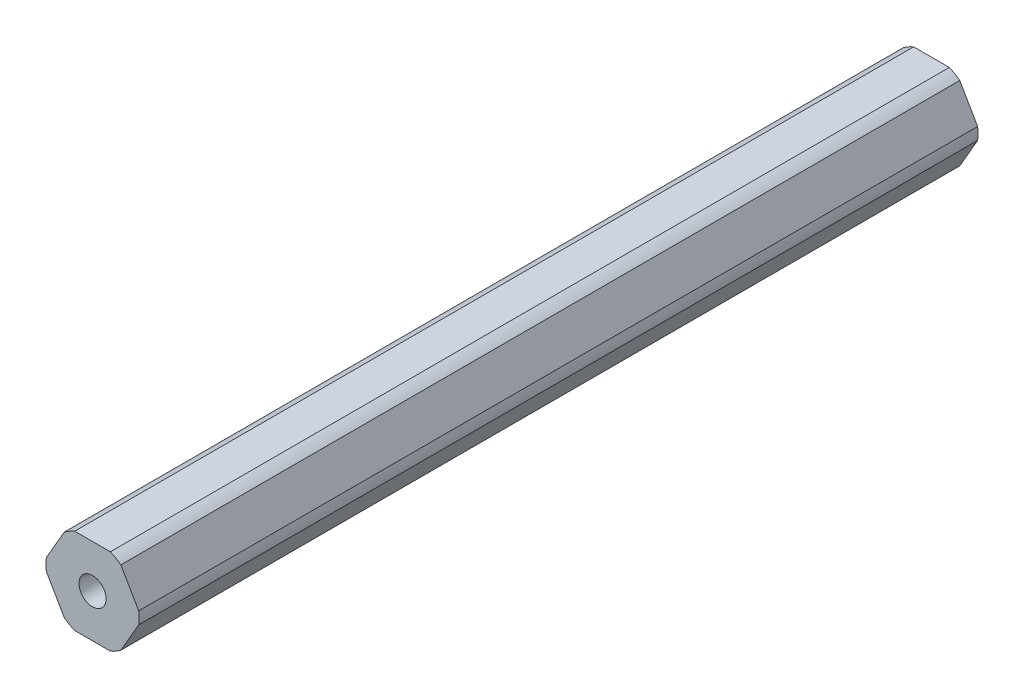
from build123d import *

# Parameters (mm, degrees)
SKETCH1_R           = 2.000000064
BOSS_EXTRUDE1_DEPTH = 61.9125


with BuildPart() as part:
    # Sketch1 → Boss-Extrude1 (new, symmetric)
    with BuildSketch(Plane.XY):
        with BuildLine():
            ThreePointArc((4.181770846, 5.456960429), (3.437499983, 5.953924622), (2.634980936, 6.35))
            Line((2.634980936, 6.35), (-2.634980936, 6.35))
            ThreePointArc((-2.634980936, 6.35), (-3.437499983, 5.953924622), (-4.181770846, 5.456960429))
            Line((-4.181770846, 5.456960429), (-6.816751782, 0.893039571))
            ThreePointArc((-6.816751782, 0.893039571), (-6.874999966, 0), (-6.816751782, -0.893039571))
            Line((-6.816751782, -0.893039571), (-4.181770846, -5.456960429))
            ThreePointArc((-4.181770846, -5.456960429), (-3.437499983, -5.953924622), (-2.634980936, -6.35))
            Line((-2.634980936, -6.35), (2.634980936, -6.35))
            ThreePointArc((2.634980936, -6.35), (3.437499983, -5.953924622), (4.181770846, -5.456960429))
            Line((4.181770846, -5.456960429), (6.816751782, -0.893039571))
            ThreePointArc((6.816751782, -0.893039571), (6.860422465, -0.447468582), (6.874999966, 0))
            ThreePointArc((6.874999966, 0), (6.860422465, 0.447468582), (6.816751782, 0.893039571))
            Line((6.816751782, 0.893039571), (4.181770846, 5.456960429))
        make_face()
        Circle(SKETCH1_R, mode=Mode.SUBTRACT)
    extrude(amount=BOSS_EXTRUDE1_DEPTH, both=True)


solid = part.part
